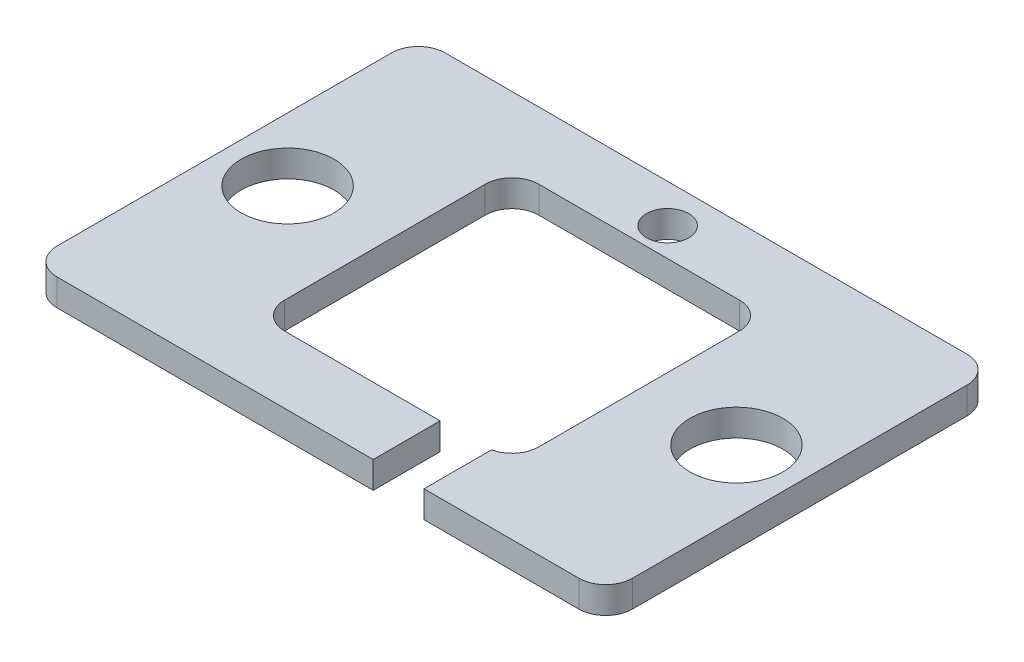
from build123d import *

# Parameters (mm, degrees)
SKETCH1_R           = 3.475
BOSS_EXTRUDE1_DEPTH = 2
SKETCH2_R           = 1.575
CUT_EXTRUDE1_DEPTH  = 27.009613607
SKETCH3_W           = 3.796627216
SKETCH3_H           = 5.505702191
CUT_EXTRUDE2_DEPTH  = 27.009613607


with BuildPart() as part:
    # Sketch1 → Boss-Extrude1 (new body)
    with BuildSketch(Plane(origin=(0, 0, 0), x_dir=(1, 0, 0), z_dir=(0, 1, 0))):
        with BuildLine():
            Line((-19.5, -14.5), (19.5, -14.5))
            ThreePointArc((19.5, -14.5), (20.914213562, -13.914213562), (21.5, -12.5))
            Line((21.5, -12.5), (21.5, 12.5))
            ThreePointArc((21.5, 12.5), (20.914213562, 13.914213562), (19.5, 14.5))
            Line((19.5, 14.5), (-19.5, 14.5))
            ThreePointArc((-19.5, 14.5), (-20.914213562, 13.914213562), (-21.5, 12.5))
            Line((-21.5, 12.5), (-21.5, -12.5))
            ThreePointArc((-21.5, -12.5), (-20.914213562, -13.914213562), (-19.5, -14.5))
        make_face()
        with Locations(Location((-16.77, 0, 0), (0, 0, 270))):
            Circle(SKETCH1_R, mode=Mode.SUBTRACT)
        with Locations(Location((16.77, 0, 0), (0, 0, 270))):
            Circle(SKETCH1_R, mode=Mode.SUBTRACT)
        with BuildLine():
            Line((-7.5, -9.5), (7.5, -9.5))
            ThreePointArc((7.5, -9.5), (8.914213562, -8.914213562), (9.5, -7.5))
            Line((9.5, -7.5), (9.5, 7.5))
            ThreePointArc((9.5, 7.5), (8.914213562, 8.914213562), (7.5, 9.5))
            Line((7.5, 9.5), (-7.5, 9.5))
            ThreePointArc((-7.5, 9.5), (-8.914213562, 8.914213562), (-9.5, 7.5))
            Line((-9.5, 7.5), (-9.5, -7.5))
            ThreePointArc((-9.5, -7.5), (-8.914213562, -8.914213562), (-7.5, -9.5))
        make_face(mode=Mode.SUBTRACT)
    extrude(amount=BOSS_EXTRUDE1_DEPTH)

    # Sketch2 → Cut-Extrude1 (cut, through all)
    with BuildSketch(Plane(origin=(0, 2, 0), x_dir=(1, 0, 0), z_dir=(0, 1, 0))):
        with Locations(Location((0, 11.63, 0), (0, 0, 270))):
            Circle(SKETCH2_R)
    extrude(amount=-CUT_EXTRUDE1_DEPTH, mode=Mode.SUBTRACT)

    # Sketch3 → Cut-Extrude2 (cut, through all)
    with BuildSketch(Plane(origin=(0, 2, 0), x_dir=(1, 0, 0), z_dir=(0, 1, 0))):
        with Locations((6.026686392, -11.747148905)):
            Rectangle(SKETCH3_W, SKETCH3_H)
    extrude(amount=-CUT_EXTRUDE2_DEPTH, mode=Mode.SUBTRACT)


solid = part.part
